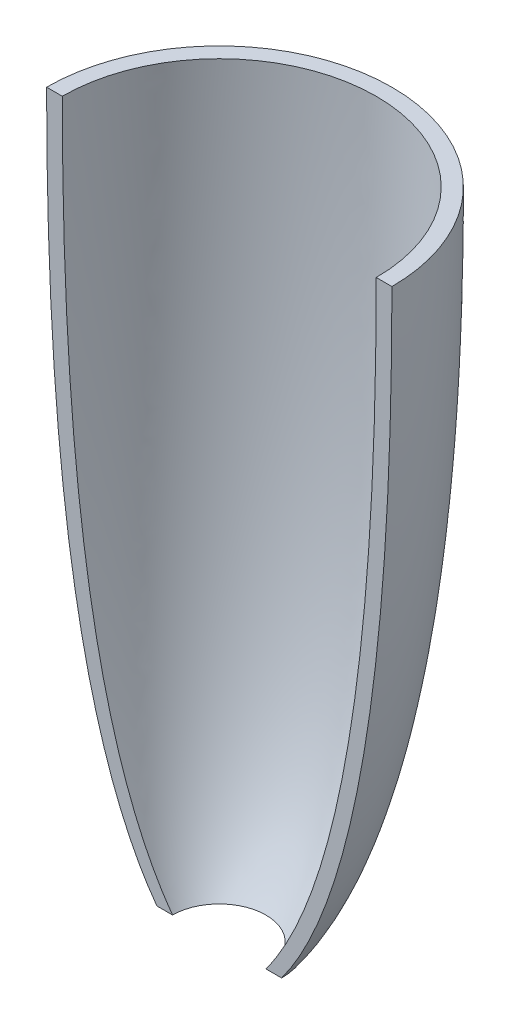
from build123d import *

# Parameters (mm, degrees)
REVOLVE1_ANGLE = 180


with BuildPart() as part:
    # Sketch2 → Revolve1 (revolve)
    with BuildSketch(Plane.XY):
        with BuildLine():
            Line((32.999747308, 124.995387398), (29.999747307, 124.995387398))
            add(Edge.make_bspline(
                [(29.999747307, 124.995387398), (29.999744787, 124.491558359), (29.998778717, 123.466958813), (29.994409039, 121.492804005), (29.98260107, 119.425003129), (29.964652603, 117.075078817), (29.940405841, 114.869694198), (29.902012332, 112.031134847), (29.822872948, 107.537736611), (29.697528586, 102.459699856), (29.508165461, 96.83431204), (29.215055152, 90.077713468), (28.851799071, 83.328575087), (28.392047627, 76.582344711), (27.821206455, 69.846460404), (27.150410489, 63.118974212), (26.371200703, 56.403449958), (25.316033476, 48.826583368), (24.018574416, 41.287276739), (22.703689511, 34.898022228), (21.454767686, 29.648726949), (20.290672347, 25.294069791), (19.031718709, 21.121220156), (17.7470521, 17.350946471), (16.593848768, 14.331959887), (15.637856993, 12.043413533), (14.952534959, 10.508297609), (14.48450836, 9.503296736), (14.088661491, 8.681846678), (13.771951211, 8.040976272), (13.401916724, 7.311330496), (12.975253523, 6.495620116), (12.48646562, 5.595335326), (11.931262766, 4.615773737), (11.370598226, 3.670329183), (10.808792247, 2.763723376), (10.317212101, 2.005634263), (9.913158537, 1.403832257), (9.571210585, 0.909784823), (9.326145202, 0.561662718), (9.098616969, 0.246765577), (8.977621835, 0.081082226), (8.917896564, -6.5515e-05)],
                knots=[0.087361097, 0.087361097, 0.087361097, 0.087361097, 0.087361097, 0.103066113, 0.118771129, 0.134476145, 0.150181161, 0.165886111, 0.181591061, 0.213000962, 0.275820149, 0.307229875, 0.3386396, 0.40145809, 0.464277391, 0.49568713, 0.527096869, 0.589916134, 0.652735207, 0.708908673, 0.740317933, 0.771727886, 0.803137433, 0.834546821, 0.861799264, 0.882738909, 0.893208716, 0.903678523, 0.908661145, 0.913643767, 0.91862639, 0.923609012, 0.931461732, 0.939314451, 0.947166907, 0.955019363, 0.962063809, 0.969108256, 0.972248998, 0.975389741, 0.978530484, 0.981671227, 0.981671227, 0.981671227, 0.981671227, 0.981671227], degree=4))
            Line((8.917896564, -6.5515e-05), (11.917896564, -6.5515e-05))
            add(Edge.make_bspline(
                [(32.999747308, 124.995387398), (32.999744789, 124.491558359), (32.998778718, 123.466958813), (32.99440904, 121.492804005), (32.982601071, 119.425003129), (32.964652604, 117.075078816), (32.940405842, 114.869694198), (32.902012333, 112.031134847), (32.822872949, 107.537736611), (32.697528587, 102.459699855), (32.508165462, 96.83431204), (32.215055153, 90.077713468), (31.851799072, 83.328575087), (31.392047628, 76.582344711), (30.821206456, 69.846460404), (30.15041049, 63.118974211), (29.371200703, 56.403449958), (28.316033477, 48.826583368), (27.018574416, 41.287276739), (25.703689512, 34.898022228), (24.454767687, 29.648726948), (23.290672347, 25.294069791), (22.031718709, 21.121220156), (20.747052101, 17.350946471), (19.593848768, 14.331959887), (18.637856994, 12.043413533), (17.952534959, 10.508297609), (17.48450836, 9.503296736), (17.088661491, 8.681846678), (16.771951211, 8.040976272), (16.401916724, 7.311330496), (15.975253523, 6.495620116), (15.48646562, 5.595335326), (14.931262766, 4.615773737), (14.370598227, 3.670329183), (13.808792247, 2.763723376), (13.317212101, 2.005634263), (12.913158537, 1.403832257), (12.571210585, 0.909784823), (12.326145202, 0.561662718), (12.098616969, 0.246765577), (11.977621835, 0.081082226), (11.917896564, -6.5515e-05)],
                knots=[0.087361097, 0.087361097, 0.087361097, 0.087361097, 0.087361097, 0.103066113, 0.118771129, 0.134476145, 0.150181161, 0.165886111, 0.181591061, 0.213000962, 0.275820149, 0.307229875, 0.3386396, 0.40145809, 0.464277391, 0.49568713, 0.527096869, 0.589916134, 0.652735207, 0.708908673, 0.740317933, 0.771727886, 0.803137433, 0.834546821, 0.861799264, 0.882738909, 0.893208716, 0.903678523, 0.908661145, 0.913643767, 0.91862639, 0.923609012, 0.931461732, 0.939314451, 0.947166907, 0.955019363, 0.962063809, 0.969108256, 0.972248998, 0.975389741, 0.978530484, 0.981671227, 0.981671227, 0.981671227, 0.981671227, 0.981671227], degree=4))
        make_face()
    revolve(axis=Axis((0, 0, 0), (0, 1, 0)), revolution_arc=REVOLVE1_ANGLE)


solid = part.part
